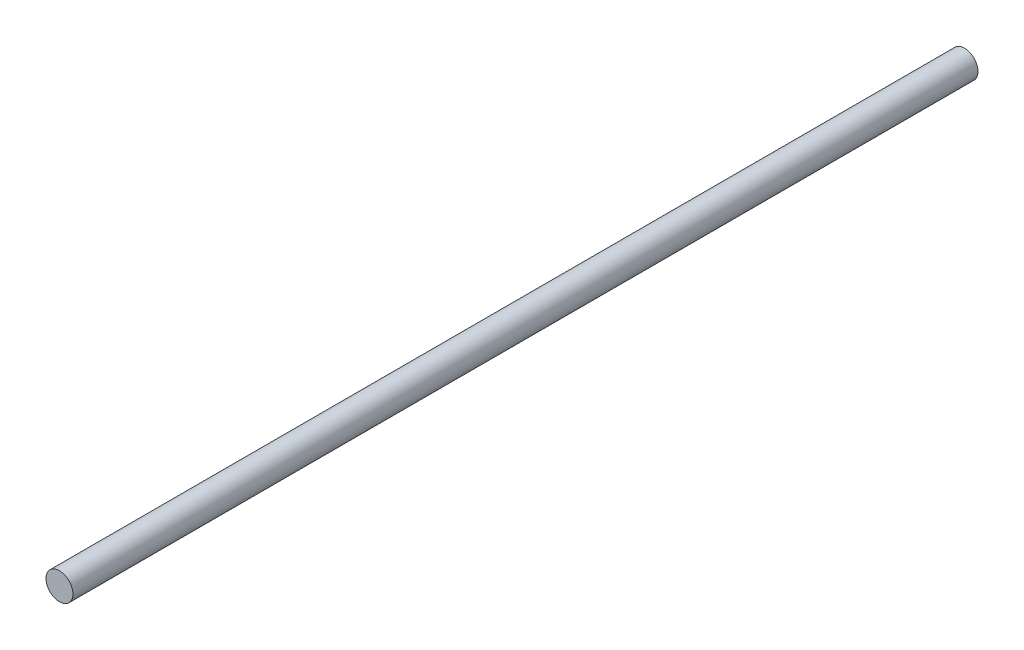
from build123d import *

# Parameters (mm, degrees)
SKETCH1_R           = 3.175
BOSS_EXTRUDE1_DEPTH = 213.106


with BuildPart() as part:
    # Sketch1 → Boss-Extrude1 (new body)
    with BuildSketch(Plane.XY):
        Circle(SKETCH1_R)
    extrude(amount=-BOSS_EXTRUDE1_DEPTH)


solid = part.part
